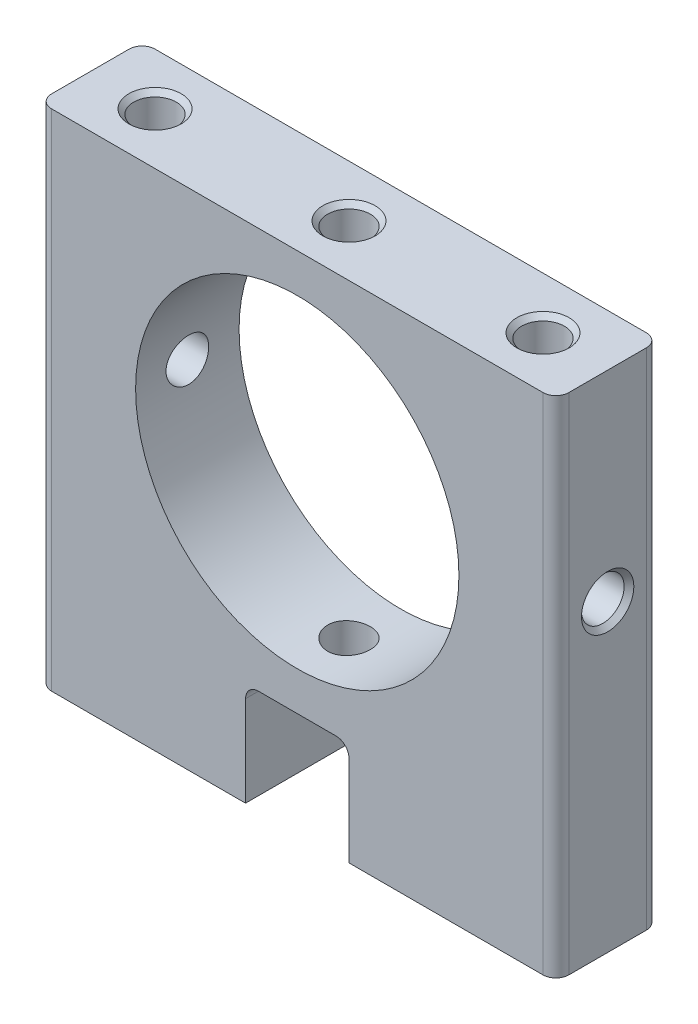
from build123d import *

# Parameters (mm, degrees)
SKETCH_1_W                   = 40
SKETCH_1_H                   = 8
EXTRUDE_1_DEPTH              = 39
HOLE_WIZARD_M4_2_D           = 3.3
HOLE_WIZARD_M4_2_DEPTH       = 8.1
HOLE_WIZARD_M4_2_CSINK_D     = 4.05
HOLE_WIZARD_M4_2_CSINK_ANGLE = 90
HOLE_WIZARD_M4_2_TIP         = 0.991420021
HOLE_WIZARD_M4_4_D           = 3.3
HOLE_WIZARD_M4_4_DEPTH       = 8.1
HOLE_WIZARD_M4_4_CSINK_D     = 4.05
HOLE_WIZARD_M4_4_CSINK_ANGLE = 90
HOLE_WIZARD_M4_4_TIP         = 0.991420021
SKETCH_11_R                  = 12.5
CUT_EXTRUDE_1_DEPTH          = 39
HOLE_WIZARD_M4_5_D           = 3.3
HOLE_WIZARD_M4_5_CSINK_D     = 4.05
HOLE_WIZARD_M4_5_CSINK_ANGLE = 90
SKETCH_14_W                  = 8
SKETCH_14_H                  = 8
CUT_EXTRUDE_2_DEPTH          = 8
HOLE_WIZARD_M4_6_D           = 3.3
HOLE_WIZARD_M4_6_CSINK_D     = 4.05
HOLE_WIZARD_M4_6_CSINK_ANGLE = 90
FILLET_1_R                   = 1
FILLET_2_R                   = 1


with BuildPart() as part:
    # 草图1 → 凸台-拉伸1 (new body)
    with BuildSketch(Plane(origin=(0, 0, 0), x_dir=(1, 0, 0), z_dir=(0, 1, 0))):
        Rectangle(SKETCH_1_W, SKETCH_1_H)
    extrude(amount=EXTRUDE_1_DEPTH)

    # M4 螺纹孔2
    with Locations(Plane(origin=(0, 39, 0), x_dir=(1, 0, 0), z_dir=(0, 1, 0))):
        with Locations((-15, 0), (15, 0)):
            CounterSinkHole(HOLE_WIZARD_M4_2_D / 2, HOLE_WIZARD_M4_2_CSINK_D / 2, depth=HOLE_WIZARD_M4_2_DEPTH, counter_sink_angle=HOLE_WIZARD_M4_2_CSINK_ANGLE)
            with Locations((0, 0, -(HOLE_WIZARD_M4_2_DEPTH + HOLE_WIZARD_M4_2_TIP / 2))):  # 118° drill point
                Cone(0, HOLE_WIZARD_M4_2_D / 2, HOLE_WIZARD_M4_2_TIP, mode=Mode.SUBTRACT)

    # M4 螺纹孔4
    with Locations(Plane(origin=(0, 0, 0), x_dir=(-1, 0, 0), z_dir=(0, -1, 0))):
        with Locations((15, 0), (-15, 0)):
            CounterSinkHole(HOLE_WIZARD_M4_4_D / 2, HOLE_WIZARD_M4_4_CSINK_D / 2, depth=HOLE_WIZARD_M4_4_DEPTH, counter_sink_angle=HOLE_WIZARD_M4_4_CSINK_ANGLE)
            with Locations((0, 0, -(HOLE_WIZARD_M4_4_DEPTH + HOLE_WIZARD_M4_4_TIP / 2))):  # 118° drill point
                Cone(0, HOLE_WIZARD_M4_4_D / 2, HOLE_WIZARD_M4_4_TIP, mode=Mode.SUBTRACT)

    # 草图11 → 切除-拉伸1 (cut)
    with BuildSketch(Plane.XY.offset(4)):
        with Locations((0, 23.5)):
            Circle(SKETCH_11_R)
    extrude(amount=-CUT_EXTRUDE_1_DEPTH, mode=Mode.SUBTRACT)

    # M4 螺纹孔5 (through all)
    with Locations(Plane(origin=(0, 39, 0), x_dir=(1, 0, 0), z_dir=(0, 1, 0))):
        with Locations((0, 0)):
            CounterSinkHole(HOLE_WIZARD_M4_5_D / 2, HOLE_WIZARD_M4_5_CSINK_D / 2, counter_sink_angle=HOLE_WIZARD_M4_5_CSINK_ANGLE)

    # 草图14 → 切除-拉伸2 (cut)
    with BuildSketch(Plane.XZ):
        Rectangle(SKETCH_14_W, SKETCH_14_H)
    extrude(amount=-CUT_EXTRUDE_2_DEPTH, mode=Mode.SUBTRACT)

    # M4 螺纹孔6 (through all)
    with Locations(Plane(origin=(20, 0, 0), x_dir=(0, 0, -1), z_dir=(1, 0, 0))):
        with Locations((0, 23.5)):
            CounterSinkHole(HOLE_WIZARD_M4_6_D / 2, HOLE_WIZARD_M4_6_CSINK_D / 2, counter_sink_angle=HOLE_WIZARD_M4_6_CSINK_ANGLE)

    # 圆角1
    fillet_1_edges = [part.edges().sort_by_distance(p)[0] for p in [
        (4, 8, 0),
        (-4, 8, 0),
    ]]
    fillet(fillet_1_edges, radius=FILLET_1_R)

    # 圆角2
    fillet_2_edges = [part.edges().sort_by_distance(p)[0] for p in [
        (20, 19.5, 4),
        (-20, 19.5, 4),
        (-20, 19.5, -4),
        (20, 19.5, -4),
    ]]
    fillet(fillet_2_edges, radius=FILLET_2_R)


solid = part.part
